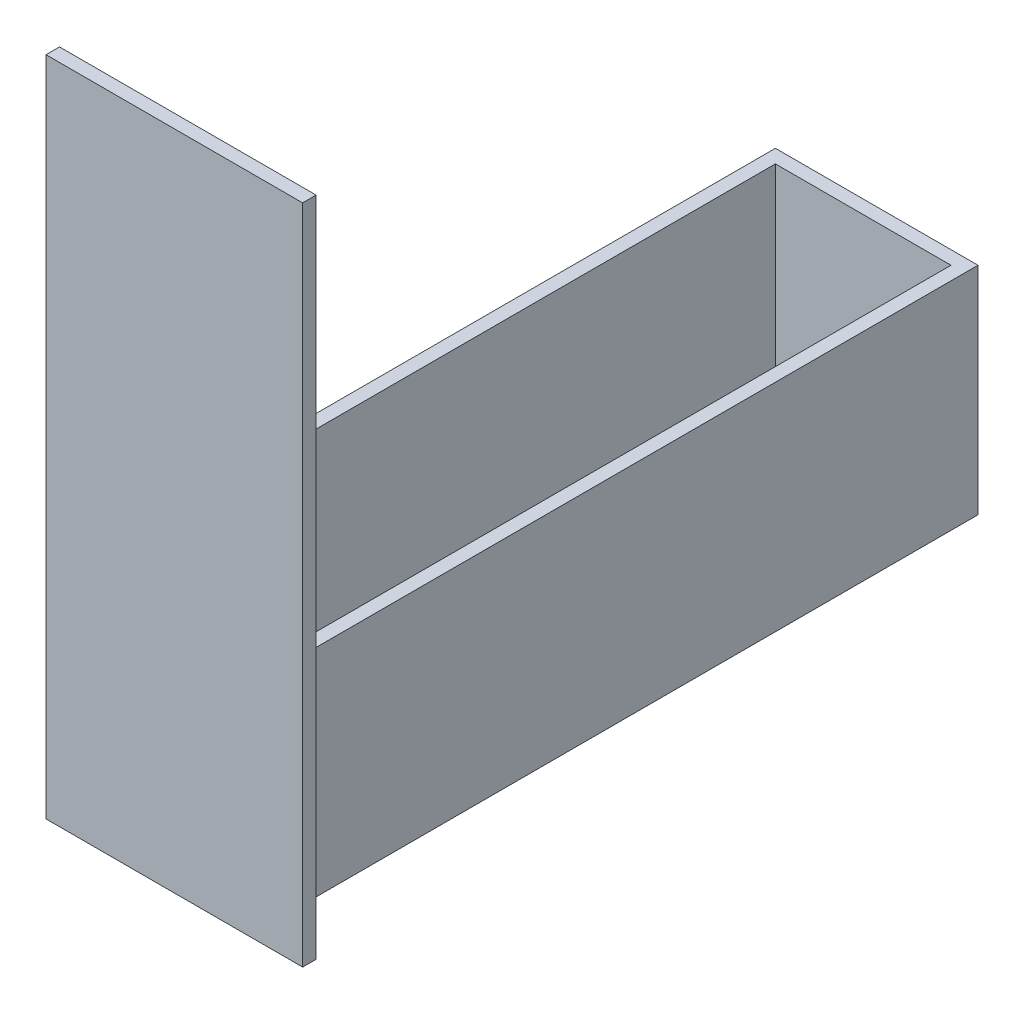
from build123d import *

# Parameters (mm, degrees)
SKETCH_1_W      = 190
SKETCH_1_H      = 490
EXTRUDE_1_DEPTH = 10
EXTRUDE_2_DEPTH = 500
SKETCH_3_W      = 150
SKETCH_3_H      = 160
EXTRUDE_3_DEPTH = 10


with BuildPart() as part:
    # Эскиз1 → Бобышка-Вытянуть1 (new body)
    with BuildSketch(Plane.XY):
        with Locations((95, 245)):
            Rectangle(SKETCH_1_W, SKETCH_1_H)
    extrude(amount=EXTRUDE_1_DEPTH)

    # Эскиз2 → Бобышка-Вытянуть2 (add)
    with BuildSketch(Plane(origin=(0, 0, 0), x_dir=(-1, 0, 0), z_dir=(0, 0, -1))):
        Polygon((-170, 180), (-170, 20), (-20, 20), (-20, 180), (-30, 180), (-30, 30), (-160, 30), (-160, 180), align=None)
    extrude(amount=EXTRUDE_2_DEPTH)

    # Эскиз3 → Бобышка-Вытянуть3 (add)
    with BuildSketch(Plane(origin=(0, 0, -500), x_dir=(-1, 0, 0), z_dir=(0, 0, -1))):
        with Locations((-95, 100)):
            Rectangle(SKETCH_3_W, SKETCH_3_H)
    extrude(amount=EXTRUDE_3_DEPTH)


solid = part.part
